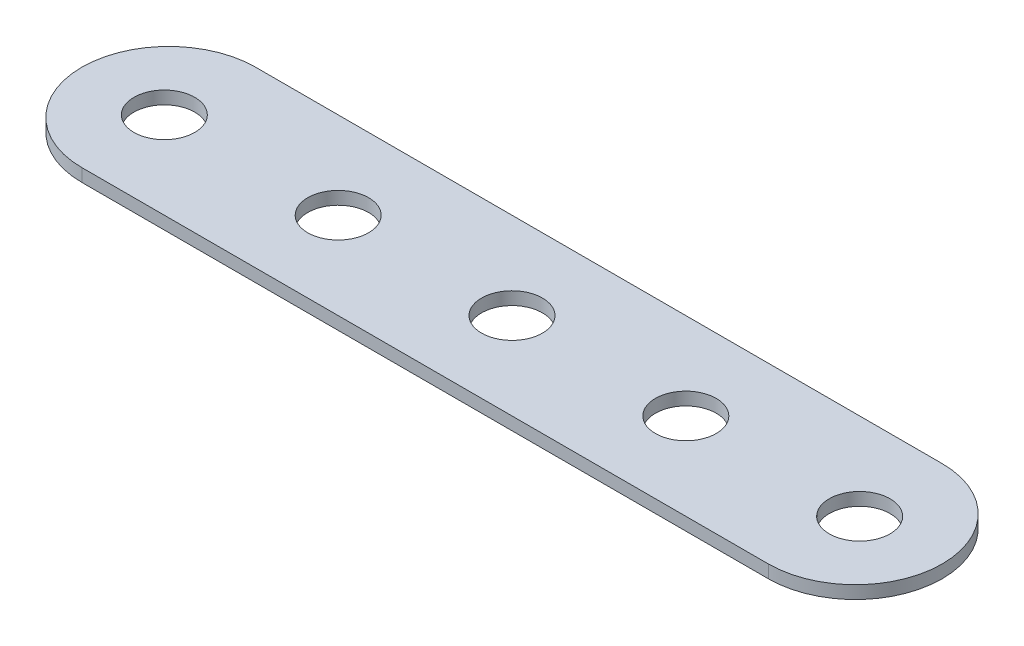
from build123d import *

# Parameters (mm, degrees)
SKETCH1_R                = 2.2225
BAR_DEPTH                = 0.9398
SKETCH2_R                = 2.2225
CENTER_HOLE_DEPTH        = 57.878387363
OTHER_CENTER_HOLES_COUNT = 3
OTHER_CENTER_HOLES_PITCH = 12.7


with BuildPart() as part:
    # Sketch1 → Bar (new body)
    with BuildSketch(Plane(origin=(0, 0, 0), x_dir=(-1, 0, 0), z_dir=(0, 1, 0))):
        with BuildLine():
            Line((50.165, 6.35), (0, 6.35))
            ThreePointArc((0, 6.35), (-6.35, 0), (0, -6.35))
            Line((0, -6.35), (50.165, -6.35))
            ThreePointArc((50.165, -6.35), (56.515, 0), (50.165, 6.35))
        make_face()
        with Locations(Location((50.4825, 0, 0), (0, 0, 90))):
            Circle(SKETCH1_R, mode=Mode.SUBTRACT)
        with Locations(Location((-0.3175, 0, 0), (0, 0, 90))):
            Circle(SKETCH1_R, mode=Mode.SUBTRACT)
    extrude(amount=BAR_DEPTH)

    # Sketch2 → Center Hole (cut, through all)
    with BuildSketch(Plane(origin=(0, 0.9398, 0), x_dir=(1, 0, 0), z_dir=(0, 1, 0))):
        with Locations(Location((-37.7825, 0, 0), (0, 0, 270))):
            Circle(SKETCH2_R)
    center_hole = extrude(amount=-CENTER_HOLE_DEPTH, mode=Mode.SUBTRACT)

    # Other Center Holes: Center Hole ×3
    with Locations(*[(i * OTHER_CENTER_HOLES_PITCH, 0, 0) for i in range(1, OTHER_CENTER_HOLES_COUNT)]):
        add(center_hole, mode=Mode.SUBTRACT)


solid = part.part
